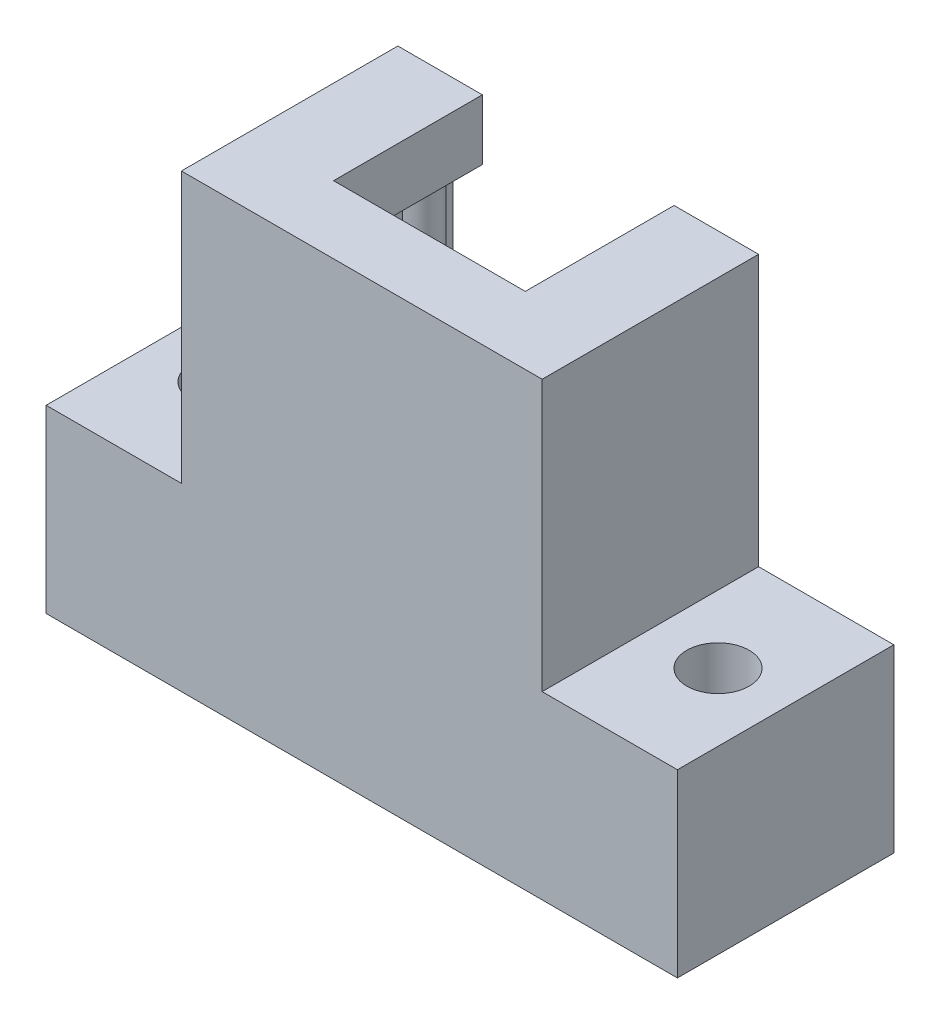
from build123d import *

# Parameters (mm, degrees)
SKETCH1_W                 = 35
SKETCH1_H                 = 12
BOSS_EXTRUDE1_DEPTH       = 10
SKETCH2_W                 = 20
SKETCH2_H                 = 12
BOSS_EXTRUDE2_DEPTH       = 25
CUT_EXTRUDE1_DEPTH        = 21.65
SKETCH6_W                 = 10.63
SKETCH6_H                 = 8.25
CUT_EXTRUDE2_DEPTH        = 3.35
SKETCH8_R                 = 1
BOSS_EXTRUDE3_DEPTH       = 21.65
CUT_EXTRUDE3_DEPTH        = 0.5
CUT_EXTRUDE3_DEPTH_BACK   = 1.5
SKETCH9_W                 = 13.86
SKETCH9_H                 = 10.85
TAP_DRILL_FOR_8_32_TAP1_D = 3.4544


with BuildPart() as part:
    # Sketch1 → Boss-Extrude1 (new body)
    with BuildSketch(Plane(origin=(0, 0, 0), x_dir=(1, 0, 0), z_dir=(0, 1, 0))):
        Rectangle(SKETCH1_W, SKETCH1_H)
    extrude(amount=BOSS_EXTRUDE1_DEPTH)

    # Sketch2 → Boss-Extrude2 (add)
    with BuildSketch(Plane(origin=(0, 0, 0), x_dir=(1, 0, 0), z_dir=(0, 1, 0))):
        Rectangle(SKETCH2_W, SKETCH2_H)
    extrude(amount=BOSS_EXTRUDE2_DEPTH)

    # Sketch5 → Cut-Extrude1 (cut)
    with BuildSketch(Plane(origin=(0, 0, 0), x_dir=(1, 0, 0), z_dir=(0, 1, 0))):
        with BuildLine():
            Line((6.93, 6), (6.93, -2.365))
            ThreePointArc((6.93, -2.365), (6.563883476, -3.248883476), (5.68, -3.615))
            Line((5.68, -3.615), (-5.68, -3.615))
            ThreePointArc((-5.68, -3.615), (-6.563883476, -3.248883476), (-6.93, -2.365))
            Line((-6.93, -2.365), (-6.93, 6))
            Line((-6.93, 6), (6.93, 6))
        make_face()
    extrude(amount=CUT_EXTRUDE1_DEPTH, mode=Mode.SUBTRACT)

    # Sketch6 → Cut-Extrude2 (cut)
    with BuildSketch(Plane(origin=(0, 25, 0), x_dir=(1, 0, 0), z_dir=(0, 1, 0))):
        with Locations((0, 1.875)):
            Rectangle(SKETCH6_W, SKETCH6_H)
    extrude(amount=-CUT_EXTRUDE2_DEPTH, mode=Mode.SUBTRACT)

    # Sketch8 → Boss-Extrude3 (add)
    with BuildSketch(Plane.XZ):
        with Locations((-6.93, -4.1762495)):
            Circle(SKETCH8_R)
        with Locations((6.93, -4.1762495)):
            Circle(SKETCH8_R)
    extrude(amount=-BOSS_EXTRUDE3_DEPTH)

    # Sketch9 → Cut-Extrude3 (cut, two sides: drawn at the far end of the back side and taken through both)
    with BuildSketch(Plane.XZ.offset(-7.21).offset(-CUT_EXTRUDE3_DEPTH_BACK)):
        Rectangle(SKETCH9_W, SKETCH9_H)
    extrude(amount=CUT_EXTRUDE3_DEPTH + CUT_EXTRUDE3_DEPTH_BACK, mode=Mode.SUBTRACT)

    # Tap Drill for #8-32 Tap1 (through all)
    with Locations(Plane(origin=(0, 10, 0), x_dir=(1, 0, 0), z_dir=(0, 1, 0))):
        with Locations((-13.75, 0), (13.75, 0)):
            Hole(TAP_DRILL_FOR_8_32_TAP1_D / 2)


solid = part.part
